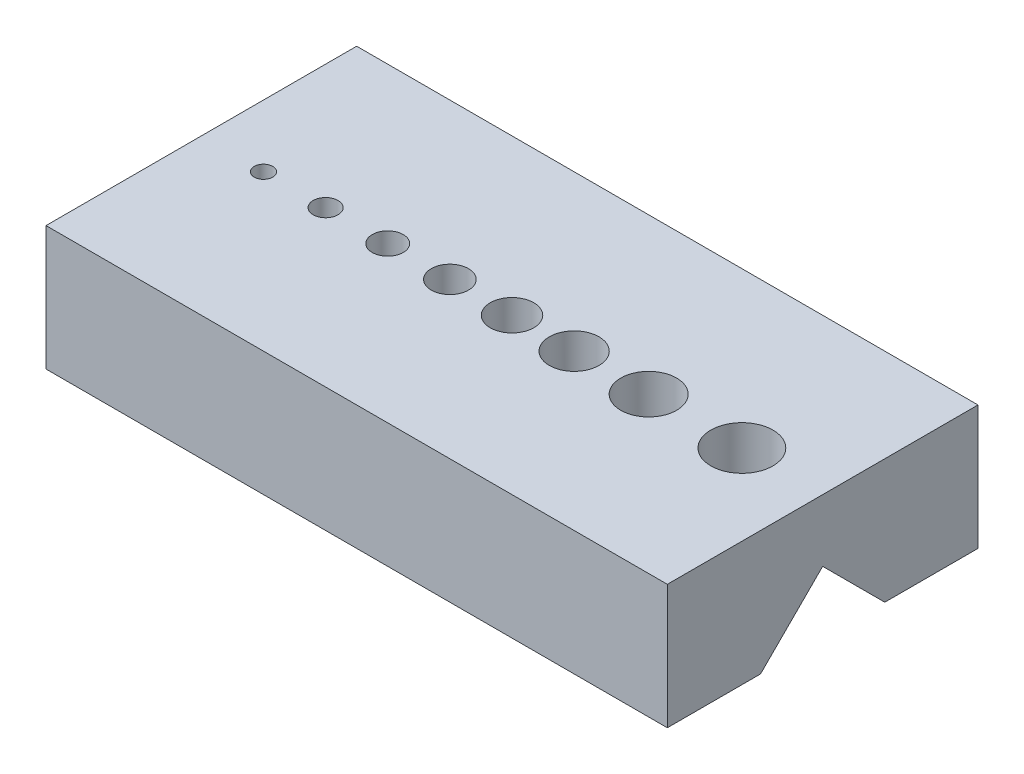
from build123d import *

# Parameters (mm, degrees)
SKETCH1_W           = 100
SKETCH1_H           = 50
SKETCH1_R           = 1.5
SKETCH1_R_2         = 2
SKETCH1_R_3         = 2.5
SKETCH1_R_4         = 3
SKETCH1_R_5         = 3.5
SKETCH1_R_6         = 4
SKETCH1_R_7         = 4.5
SKETCH1_R_8         = 5
BOSS_EXTRUDE1_DEPTH = 20
CUT_EXTRUDE2_DEPTH  = 114.578166916


with BuildPart() as part:
    # Sketch1 → Boss-Extrude1 (new body)
    with BuildSketch(Plane(origin=(0, 0, 0), x_dir=(1, 0, 0), z_dir=(0, 1, 0))):
        with Locations((50, 25)):
            Rectangle(SKETCH1_W, SKETCH1_H)
        with Locations(Location((10, 25, 0), (0, 0, 270))):
            Circle(SKETCH1_R, mode=Mode.SUBTRACT)
        with Locations(Location((20, 25, 0), (0, 0, 270))):
            Circle(SKETCH1_R_2, mode=Mode.SUBTRACT)
        with Locations(Location((30, 25, 0), (0, 0, 270))):
            Circle(SKETCH1_R_3, mode=Mode.SUBTRACT)
        with Locations(Location((40, 25, 0), (0, 0, 270))):
            Circle(SKETCH1_R_4, mode=Mode.SUBTRACT)
        with Locations(Location((50, 25, 0), (0, 0, 270))):
            Circle(SKETCH1_R_5, mode=Mode.SUBTRACT)
        with Locations(Location((60, 25, 0), (0, 0, 270))):
            Circle(SKETCH1_R_6, mode=Mode.SUBTRACT)
        with Locations(Location((72, 25, 0), (0, 0, 270))):
            Circle(SKETCH1_R_7, mode=Mode.SUBTRACT)
        with Locations(Location((87, 25, 0), (0, 0, 270))):
            Circle(SKETCH1_R_8, mode=Mode.SUBTRACT)
    extrude(amount=BOSS_EXTRUDE1_DEPTH)

    # Sketch2 → Cut-Extrude2 (cut, through all)
    with BuildSketch(Plane(origin=(100, 0, 0), x_dir=(0, 0, -1), z_dir=(1, 0, 0))):
        Polygon((15, 0), (25, 10), (35, 0), align=None)
    extrude(amount=-CUT_EXTRUDE2_DEPTH, mode=Mode.SUBTRACT)


solid = part.part
